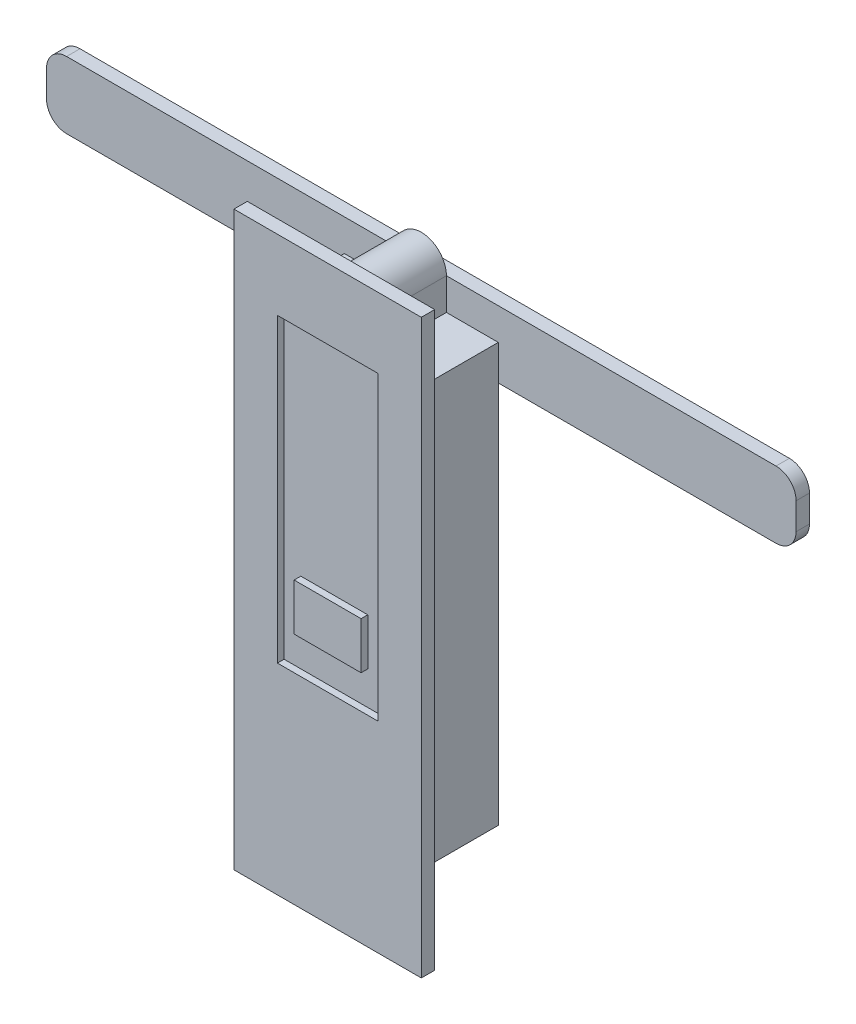
from build123d import *

# Parameters (mm, degrees)
SKETCH_1_W          = 28
SKETCH_1_H          = 85.5
EXTRUDE_1_DEPTH     = 2
SKETCH_2_W          = 15
SKETCH_2_H          = 45
SKETCH_2_W_2        = 10
SKETCH_2_H_2        = 7
CUT_EXTRUDE_1_DEPTH = 1
SKETCH_3_W          = 7.5
SKETCH_3_H          = 62.5
SKETCH_3_W_2        = 7.75
EXTRUDE_2_DEPTH     = 12
EXTRUDE_3_DEPTH     = 2


with BuildPart() as part:
    # 草图1 → 凸台-拉伸1 (new body)
    with BuildSketch(Plane.XY):
        Rectangle(SKETCH_1_W, SKETCH_1_H)
    extrude(amount=EXTRUDE_1_DEPTH)

    # 草图2 → 切除-拉伸1 (cut)
    with BuildSketch(Plane.XY.offset(2)):
        with Locations((0, 9.75)):
            Rectangle(SKETCH_2_W, SKETCH_2_H)
        with Locations((0, -4.25)):
            Rectangle(SKETCH_2_W_2, SKETCH_2_H_2, mode=Mode.SUBTRACT)
    extrude(amount=-CUT_EXTRUDE_1_DEPTH, mode=Mode.SUBTRACT)

    # 草图3 → 凸台-拉伸2 (add)
    with BuildSketch(Plane(origin=(0, 0, 0), x_dir=(-1, 0, 0), z_dir=(0, 0, -1))):
        Rectangle(SKETCH_3_W, SKETCH_3_H)
        with Locations((-7.625, 0)):
            Rectangle(SKETCH_3_W_2, SKETCH_3_H)
        with Locations((7.625, 0)):
            Rectangle(SKETCH_3_W_2, SKETCH_3_H)
        with BuildLine():
            Line((-3.75, 36), (-3.75, 31.25))
            Line((-3.75, 31.25), (3.75, 31.25))
            Line((3.75, 31.25), (3.75, 36))
            ThreePointArc((3.75, 36), (0, 39.75), (-3.75, 36))
        make_face()
        with BuildLine():
            Line((3.75, -31.25), (-3.75, -31.25))
            Line((-3.75, -31.25), (-3.75, -36))
            ThreePointArc((-3.75, -36), (0, -39.75), (3.75, -36))
            Line((3.75, -36), (3.75, -31.25))
        make_face()
    extrude(amount=EXTRUDE_2_DEPTH)


with BuildPart() as body_2:
    # 草图4 → 凸台-拉伸3 (new body)
    with BuildSketch(Plane(origin=(0, 0, -12), x_dir=(-1, 0, 0), z_dir=(0, 0, -1))):
        with BuildLine():
            Line((0, 36), (53, 36))
            ThreePointArc((53, 36), (55.121320344, 35.121320344), (56, 33))
            Line((56, 33), (56, 29))
            ThreePointArc((56, 29), (55.121320344, 26.878679656), (53, 26))
            Line((53, 26), (0, 26))
            Line((0, 26), (0, 36))
        make_face()
    extrude(amount=EXTRUDE_3_DEPTH)


with BuildPart() as body_3:
    # 镜向2: mirrored copy
    add(body_2.part.mirror(Plane(origin=(0, 0, 0), x_dir=(0, 0, 1), z_dir=(1, 0, 0))))


solid = Compound([part.part, body_2.part, body_3.part])
